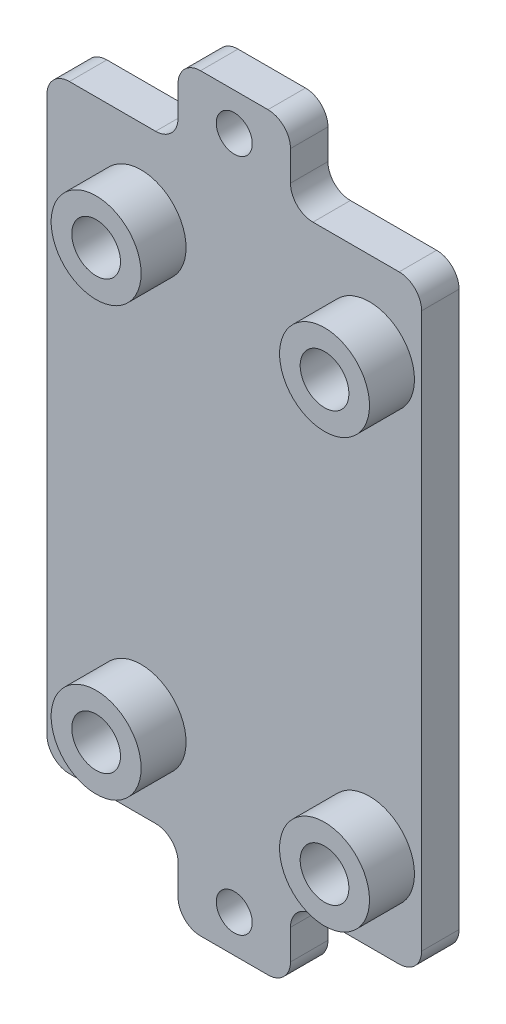
from build123d import *

# Parameters (mm, degrees)
SKETCH3_W            = 50
SKETCH3_H            = 80
BOSS_EXTRUDE1_DEPTH  = 5
SKETCH5_R            = 6
SKETCH5_R_2          = 3.25
BOSS_EXTRUDE2_DEPTH  = 6
BOSS_EXTRUDE3_DEPTH  = 5
M4_CLEARANCE_HOLE1_D = 4.8
FILLET1_R            = 3


with BuildPart() as part:
    # Sketch3 → Boss-Extrude1 (new body)
    with BuildSketch(Plane.XY):
        Rectangle(SKETCH3_W, SKETCH3_H)
    extrude(amount=BOSS_EXTRUDE1_DEPTH)

    # Sketch5 → Boss-Extrude2 (add)
    # profile 1 of 4: a face of its own
    with BuildSketch(Plane.XY.offset(5)):
        with Locations((-12.434, -28.575)):
            Circle(SKETCH5_R)
        with Locations((-12.434, -28.575)):
            Circle(SKETCH5_R_2, mode=Mode.SUBTRACT)
    # profile 2 of 4: a face of its own
    with BuildSketch(Plane.XY.offset(5)):
        with Locations((18.046, -28.575)):
            Circle(SKETCH5_R)
        with Locations((18.046, -28.575)):
            Circle(SKETCH5_R_2, mode=Mode.SUBTRACT)
    # profile 3 of 4: a face of its own
    with BuildSketch(Plane.XY.offset(5)):
        with Locations((-12.434, 28.575)):
            Circle(SKETCH5_R)
        with Locations((-12.434, 28.575)):
            Circle(SKETCH5_R_2, mode=Mode.SUBTRACT)
    # profile 4 of 4: a face of its own
    with BuildSketch(Plane.XY.offset(5)):
        with Locations((18.046, 28.575)):
            Circle(SKETCH5_R)
        with Locations((18.046, 28.575)):
            Circle(SKETCH5_R_2, mode=Mode.SUBTRACT)
    extrude(amount=BOSS_EXTRUDE2_DEPTH)

    # Sketch8 → Boss-Extrude3 (add)
    with BuildSketch(Plane.XY.offset(5)):
        with BuildLine():
            Line((0, 43), (0, 40))
            Line((0, 40), (7.5, 40))
            Line((7.5, 40), (7.5, 50))
            Line((7.5, 50), (0, 50))
            Line((0, 50), (0, 47))
            ThreePointArc((0, 47), (1.414213562, 46.414213562), (2, 45))
            ThreePointArc((2, 45), (1.414213562, 43.585786438), (0, 43))
        make_face()
        with BuildLine():
            Line((-7.5, 50), (-7.5, 40))
            Line((-7.5, 40), (0, 40))
            Line((0, 40), (0, 43))
            ThreePointArc((0, 43), (-2, 45), (0, 47))
            Line((0, 47), (0, 50))
            Line((0, 50), (-7.5, 50))
        make_face()
        with BuildLine():
            ThreePointArc((0, 47), (-2, 45), (0, 43))
            Line((0, 43), (0, 47))
        make_face()
        with BuildLine():
            Line((0, 47), (0, 43))
            ThreePointArc((0, 43), (1.414213562, 43.585786438), (2, 45))
            ThreePointArc((2, 45), (1.414213562, 46.414213562), (0, 47))
        make_face()
    boss_extrude3 = extrude(amount=-BOSS_EXTRUDE3_DEPTH)

    # M4 Clearance Hole1 (through all)
    with Locations(Plane.XY.offset(5)):
        with Locations((0, 45)):
            m4_clearance_hole1 = Hole(M4_CLEARANCE_HOLE1_D / 2)

    # Mirror1: Boss-Extrude3, M4 Clearance Hole1 across plane
    add(boss_extrude3.mirror(Plane.ZX))
    add(m4_clearance_hole1.mirror(Plane.ZX), mode=Mode.SUBTRACT)

    # Fillet1
    fillet1_edges = [part.edges().sort_by_distance(p)[0] for p in [
        (-7.5, 40, 2.5),
        (-7.5, 50, 2.5),
        (7.5, 50, 2.5),
        (7.5, 40, 2.5),
        (-7.5, -50, 2.5),
        (-7.5, -40, 2.5),
        (7.5, -40, 2.5),
        (7.5, -50, 2.5),
        (25, -40, 2.5),
        (-25, -40, 2.5),
        (-25, 40, 2.5),
        (25, 40, 2.5),
    ]]
    fillet(fillet1_edges, radius=FILLET1_R)


solid = part.part
